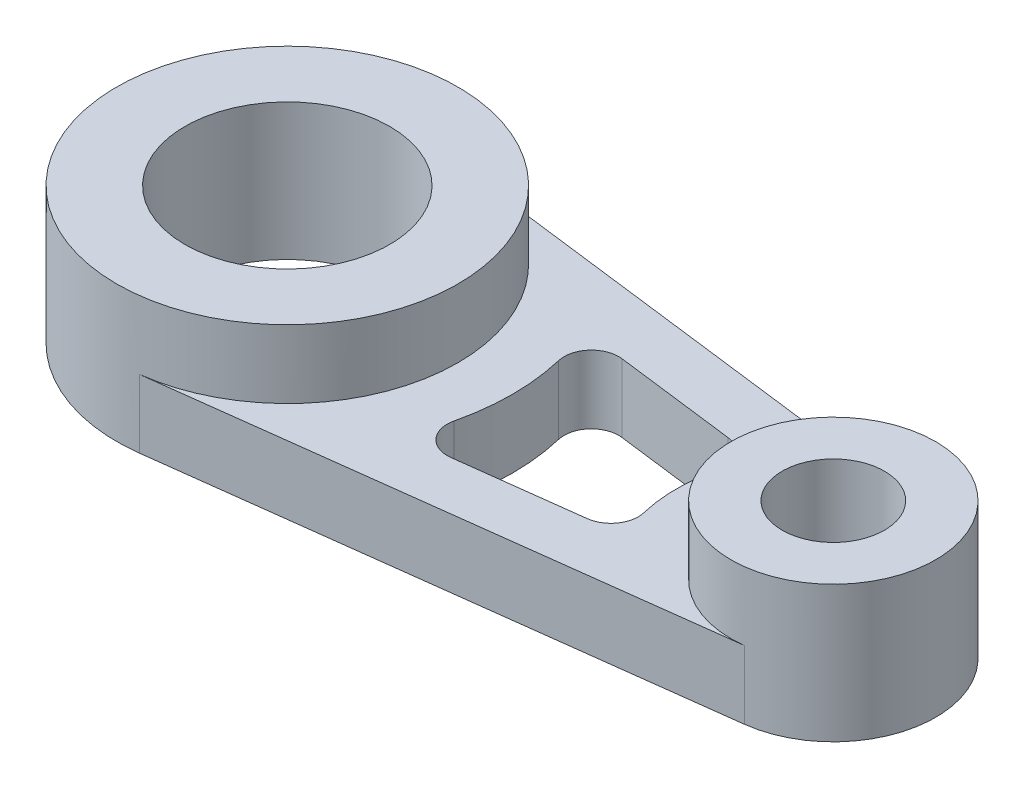
from build123d import *

# Parameters (mm, degrees)
SKETCH1_R           = 7.5
SKETCH1_R_2         = 15
BOSS_EXTRUDE1_DEPTH = 10
SKETCH1_3_R         = 25
SKETCH1_3_R_2       = 15
SKETCH1_3_R_3       = 7.5
BOSS_EXTRUDE2_DEPTH = 20
CUT_EXTRUDE1_DEPTH  = 20


with BuildPart() as part:
    # Sketch1 → Boss-Extrude1 (new body)
    with BuildSketch(Plane(origin=(0, 0, 0), x_dir=(1, 0, 0), z_dir=(0, 1, 0))):
        with BuildLine():
            Line((81.875, 14.882351125), (3.125, 24.803918541))
            ThreePointArc((3.125, 24.803918541), (-25, 0), (3.125, -24.803918541))
            Line((3.125, -24.803918541), (81.875, -14.882351125))
            ThreePointArc((81.875, -14.882351125), (95, 0), (81.875, 14.882351125))
        make_face()
        with Locations((80, 0)):
            Circle(SKETCH1_R, mode=Mode.SUBTRACT)
        Circle(SKETCH1_R_2, mode=Mode.SUBTRACT)
    extrude(amount=BOSS_EXTRUDE1_DEPTH)

    # Sketch1<3> → Boss-Extrude2 (add)
    # profile 1 of 2: a face of its own
    with BuildSketch(Plane(origin=(0, 0, 0), x_dir=(1, 0, 0), z_dir=(0, 1, 0))):
        Circle(SKETCH1_3_R)
        Circle(SKETCH1_3_R_2, mode=Mode.SUBTRACT)
    # profile 2 of 2: a face of its own
    with BuildSketch(Plane(origin=(0, 0, 0), x_dir=(1, 0, 0), z_dir=(0, 1, 0))):
        with Locations((80, 0)):
            Circle(SKETCH1_3_R_2)
        with Locations((80, 0)):
            Circle(SKETCH1_3_R_3, mode=Mode.SUBTRACT)
    extrude(amount=BOSS_EXTRUDE2_DEPTH)

    # Sketch2 → Cut-Extrude1 (cut)
    with BuildSketch(Plane(origin=(0, 10, 0), x_dir=(1, 0, 0), z_dir=(0, 1, 0))):
        with BuildLine():
            Line((36.494317712, -12.536537589), (54.252640976, -10.299199158))
            ThreePointArc((54.252640976, -10.299199158), (57.044014201, -8.603645506), (57.641138609, -5.392709644))
            ThreePointArc((57.641138609, -5.392709644), (57, 0), (57.641138609, 5.392709644))
            ThreePointArc((57.641138609, 5.392709644), (57.044014201, 8.603645506), (54.252640976, 10.299199158))
            Line((54.252640976, 10.299199158), (36.494317712, 12.536537589))
            ThreePointArc((36.494317712, 12.536537589), (33.016873839, 11.239020501), (32.103040122, 7.641650015))
            ThreePointArc((32.103040122, 7.641650015), (33, 0), (32.103040122, -7.641650015))
            ThreePointArc((32.103040122, -7.641650015), (33.016873839, -11.239020501), (36.494317712, -12.536537589))
        make_face()
    extrude(amount=-CUT_EXTRUDE1_DEPTH, mode=Mode.SUBTRACT)


solid = part.part
